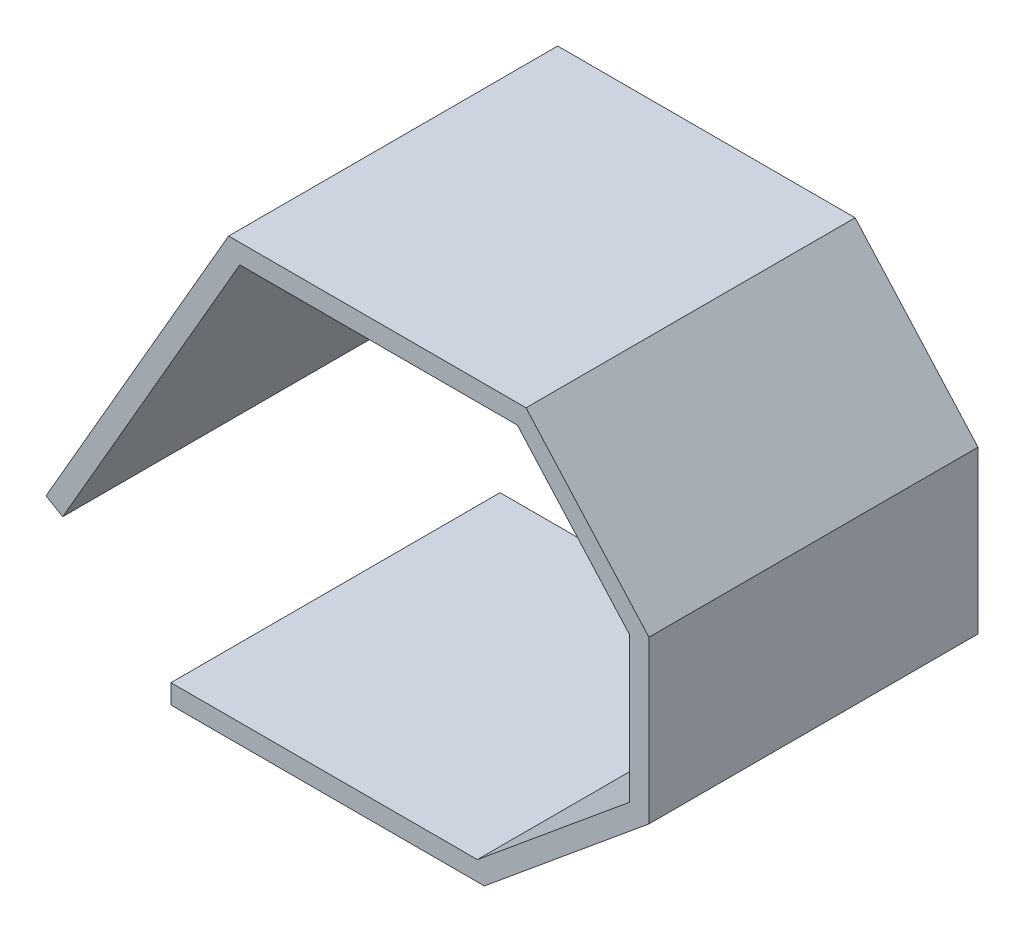
from build123d import *

# Parameters (mm, degrees)
BOSS_EXTRUDE1_DEPTH = 170


with BuildPart() as part:
    # Sketch1 → Boss-Extrude1 (new body)
    with BuildSketch(Plane.XY):
        Polygon((-117.050914431, -44.075964259), (41.240668312, -44.075964259), (119.855692283, 20.878088333), (119.855692283, 95.884553826), (61.918082693, 160.62673846), (-81.485965038, 160.62673846), (-172.927457267, 2.245427999), (-181.587711305, 7.245427999), (-87.25946773, 170.62673846), (66.388651902, 170.62673846), (129.855692283, 99.70571021), (129.855692283, 16.168663405), (44.837392928, -54.075964259), (-117.050914431, -54.075964259), align=None)
    extrude(amount=BOSS_EXTRUDE1_DEPTH)


solid = part.part
